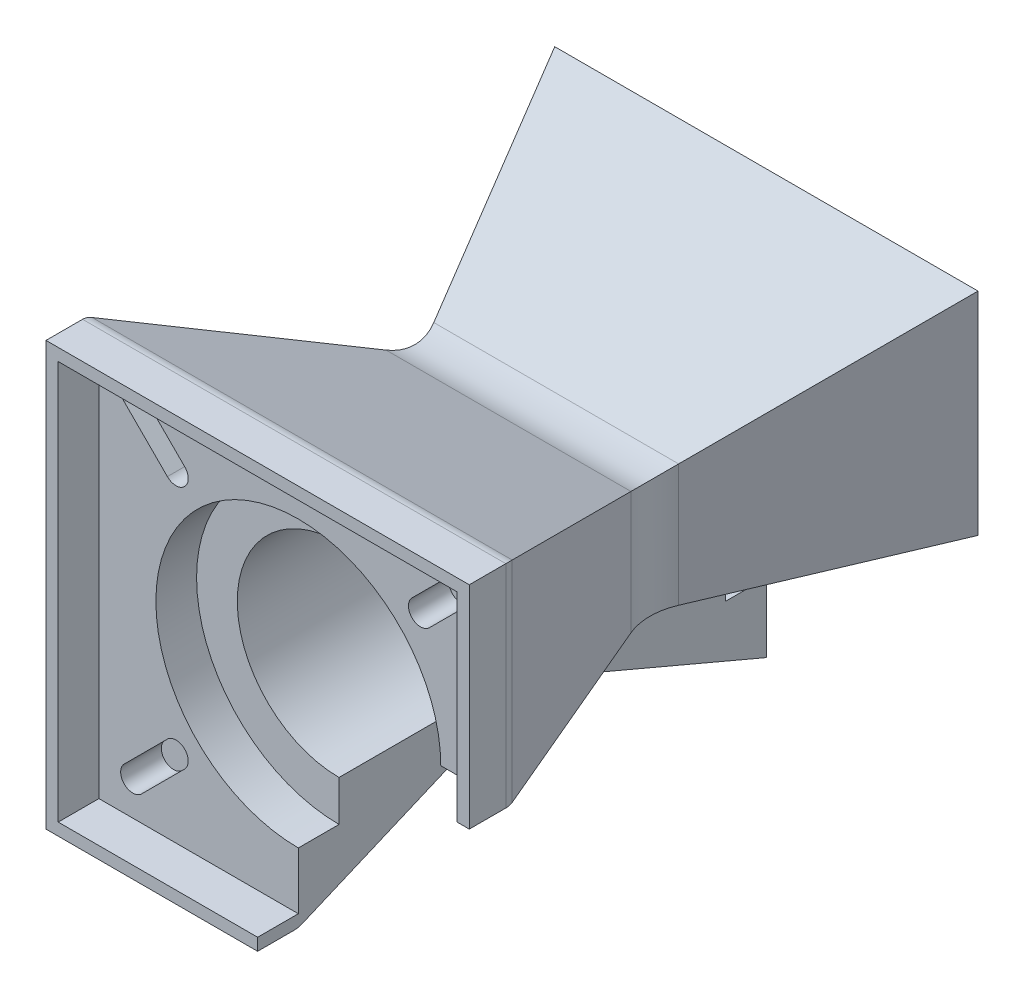
from build123d import *

# Parameters (mm, degrees)
SKETCH1_W               = 104
SKETCH1_H               = 104
BOSS_EXTRUDE1_DEPTH     = 57.5
BOSS_EXTRUDE1_TAPER     = 23
CUT_EXTRUDE1_DEPTH      = 137.502747225
CUT_EXTRUDE1_DEPTH_BACK = 137.502747225
SKETCH2_R               = 25
SKETCH3_R               = 35
CUT_EXTRUDE2_DEPTH      = 10
SKETCH4_W               = 52
SKETCH4_H               = 52
CUT_EXTRUDE3_DEPTH      = 137.502747225
FILLET1_R               = 15
BOSS_EXTRUDE3_DEPTH     = 10
FILLET2_R               = 5
CUT_EXTRUDE4_DEPTH      = 10


with BuildPart() as part:
    # Sketch1 → Boss-Extrude1 (new body)
    with BuildSketch(Plane.XY):
        Rectangle(SKETCH1_W, SKETCH1_H)
    extrude(amount=BOSS_EXTRUDE1_DEPTH, taper=BOSS_EXTRUDE1_TAPER)

    # Mirror1: part across plane


with BuildPart() as part_1:
    add(part.part)
    add(part.part.mirror(Plane.XY.offset(57.5)))

    # Sketch2 → Cut-Extrude1 (cut, two sides: drawn at the far end of the back side and taken through both)
    with BuildSketch(Plane.XY.offset(115).offset(-CUT_EXTRUDE1_DEPTH_BACK)):
        Circle(SKETCH2_R)
    extrude(amount=CUT_EXTRUDE1_DEPTH + CUT_EXTRUDE1_DEPTH_BACK, mode=Mode.SUBTRACT)

    # Sketch3 → Cut-Extrude2 (cut)
    with BuildSketch(Plane.XY.offset(115)):
        Circle(SKETCH3_R)
    cut_extrude2 = extrude(amount=-CUT_EXTRUDE2_DEPTH, mode=Mode.SUBTRACT)

    # Mirror2: Cut-Extrude2 across plane
    add(cut_extrude2.mirror(Plane.XY.offset(57.5)), mode=Mode.SUBTRACT)

    # Sketch4 → Cut-Extrude3 (cut, through all)
    with BuildSketch(Plane.XY.offset(115)):
        with Locations((26, -26)):
            Rectangle(SKETCH4_W, SKETCH4_H)
    extrude(amount=-CUT_EXTRUDE3_DEPTH, mode=Mode.SUBTRACT)

    # Fillet1
    fillet1_edges = [part_1.edges().sort_by_distance(p)[0] for p in [
        (0, 27.592698068, 57.5),
        (-27.592698068, 0, 57.5),
        (-13.796349034, -27.592698068, 57.5),
        (27.592698068, 13.796349034, 57.5),
    ]]
    fillet(fillet1_edges, radius=FILLET1_R)

    # Sketch5 → Boss-Extrude3 (add)
    with BuildSketch(Plane.XY.offset(115)):
        Polygon((-52, -52), (0, -52), (0, -49), (-49, -49), (-49, 49), (49, 49), (49, 0), (52, 0), (52, 52), (-52, 52), align=None)
    extrude(amount=BOSS_EXTRUDE3_DEPTH)

    # Fillet2
    fillet2_edges = [part_1.edges().sort_by_distance(p)[0] for p in [
        (0, 52, 115),
        (-52, 0, 115),
        (-26, -52, 115),
        (52, 26, 115),
    ]]
    fillet(fillet2_edges, radius=FILLET2_R)

    # Sketch6 → Cut-Extrude4 (cut)
    with BuildSketch(Plane.XY.offset(115)):
        with BuildLine():
            Line((-38.537319575, 42.779960262), (-27.930717857, 32.173358544))
            ThreePointArc((-27.930717857, 32.173358544), (-27.930717857, 27.930717857), (-32.173358544, 27.930717857))
            Line((-32.173358544, 27.930717857), (-42.779960262, 38.537319575))
            ThreePointArc((-42.779960262, 38.537319575), (-42.779960262, 42.779960262), (-38.537319575, 42.779960262))
        make_face()
        with BuildLine():
            Line((42.779960262, 38.537319575), (32.173358544, 27.930717857))
            ThreePointArc((32.173358544, 27.930717857), (27.930717857, 27.930717857), (27.930717857, 32.173358544))
            Line((27.930717857, 32.173358544), (38.537319575, 42.779960262))
            ThreePointArc((38.537319575, 42.779960262), (42.779960262, 42.779960262), (42.779960262, 38.537319575))
        make_face()
        with BuildLine():
            Line((38.537319575, -42.779960262), (27.930717857, -32.173358544))
            ThreePointArc((27.930717857, -32.173358544), (27.930717857, -27.930717857), (32.173358544, -27.930717857))
            Line((32.173358544, -27.930717857), (42.779960262, -38.537319575))
            ThreePointArc((42.779960262, -38.537319575), (42.779960262, -42.779960262), (38.537319575, -42.779960262))
        make_face()
        with BuildLine():
            Line((-42.779960262, -38.537319575), (-32.173358544, -27.930717857))
            ThreePointArc((-32.173358544, -27.930717857), (-27.930717857, -27.930717857), (-27.930717857, -32.173358544))
            Line((-27.930717857, -32.173358544), (-38.537319575, -42.779960262))
            ThreePointArc((-38.537319575, -42.779960262), (-42.779960262, -42.779960262), (-42.779960262, -38.537319575))
        make_face()
    extrude(amount=-CUT_EXTRUDE4_DEPTH, mode=Mode.SUBTRACT)


solid = part_1.part
